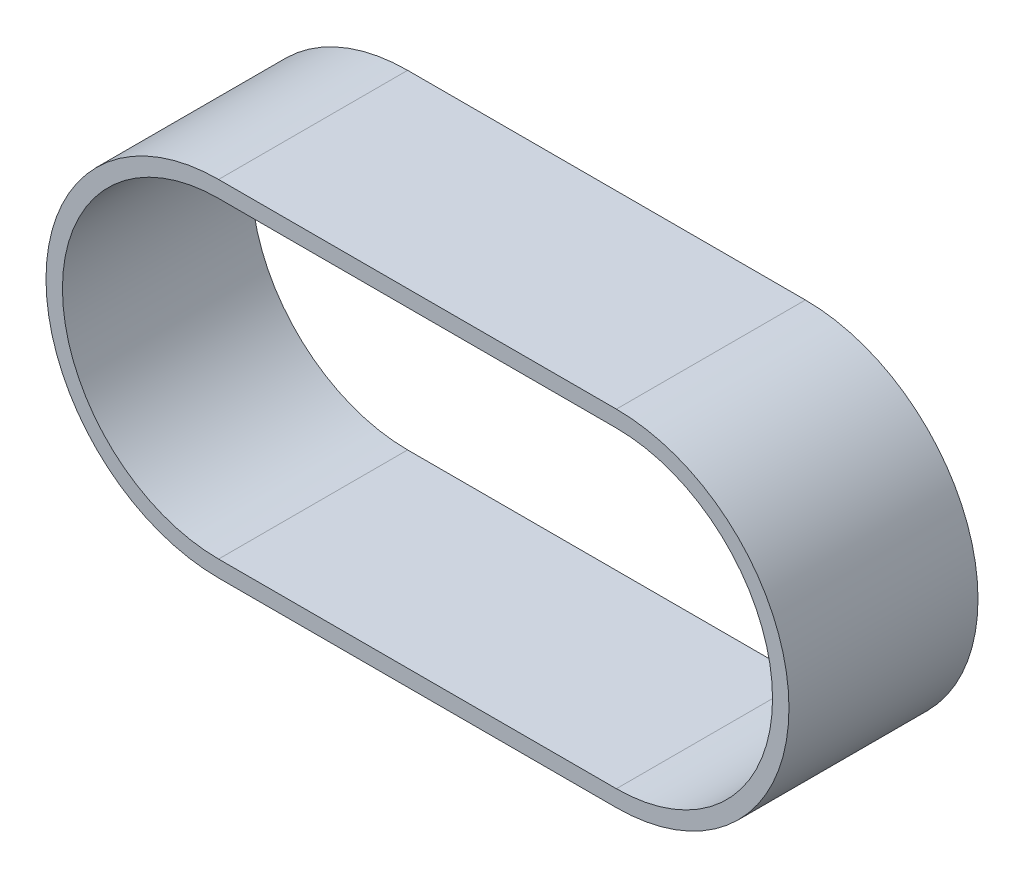
from build123d import *

# Parameters (mm, degrees)
ESTRUSIONE_ESTRUSIONE1_DEPTH = 115


with BuildPart() as part:
    # Schizzo1 → Estrusione-Estrusione1 (new body)
    with BuildSketch(Plane.XY):
        with BuildLine():
            Line((-121, 105), (121, 105))
            ThreePointArc((121, 105), (226, 0), (121, -105))
            Line((121, -105), (-121, -105))
            ThreePointArc((-121, -105), (-226, 0), (-121, 105))
        make_face()
        with BuildLine():
            Line((-121, 95), (121, 95))
            ThreePointArc((121, 95), (216, 0), (121, -95))
            Line((121, -95), (-121, -95))
            ThreePointArc((-121, -95), (-216, 0), (-121, 95))
        make_face(mode=Mode.SUBTRACT)
    extrude(amount=ESTRUSIONE_ESTRUSIONE1_DEPTH)


solid = part.part
